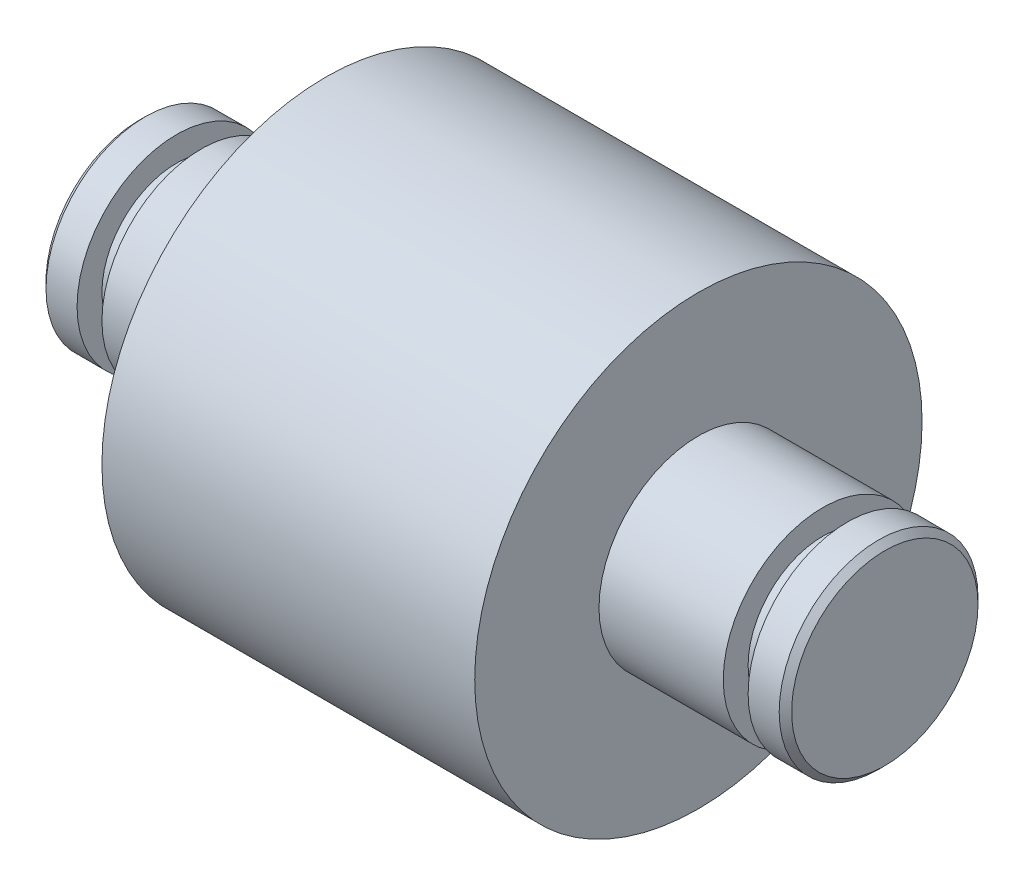
from build123d import *

# Parameters (mm, degrees)
CHAMFER1_SIZE = 0.25


with BuildPart() as part:
    # Sketch1 → Revolve4 (revolve)
    with BuildSketch(Plane.XY, mode=Mode.PRIVATE) as revolve4_sk:
        Polygon((15, 4), (15, 0), (-15, 0), (-15, 4), (-13.5, 4), (-13.5, 3), (-12.5, 3), (-12.5, 4), (-7.5, 4), (-7.5, 9), (7.5, 9), (7.5, 4), (12.5, 4), (12.5, 3), (13.5, 3), (13.5, 4), align=None)
    revolve(revolve4_sk.sketch.rotate(Axis((-15, 0, 0), (1, 0, 0)), 90), axis=Axis((-15, 0, 0), (1, 0, 0)))

    # Chamfer1
    chamfer1_edges = [part.edges().sort_by_distance(p)[0] for p in [
        (-15, 0, -4),
        (15, 0, -4),
    ]]
    chamfer(chamfer1_edges, length=CHAMFER1_SIZE)


solid = part.part
